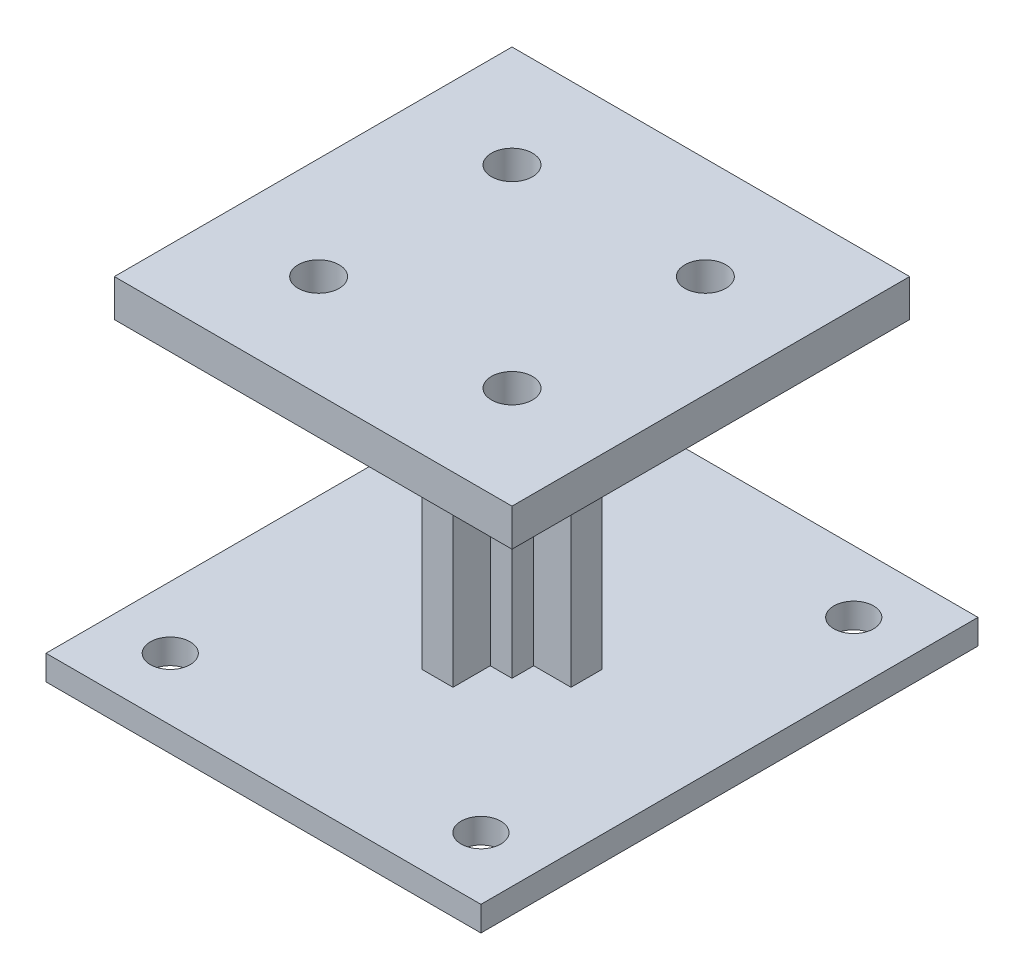
from build123d import *

# Parameters (mm, degrees)
SKETCH_1_W               = 35
SKETCH_1_H               = 40
EXTRUDE_1_DEPTH          = 2
SKETCH_2_R               = 1.6
CUT_EXTRUDE_1_DEPTH      = 2
SKETCH_3_W               = 6
SKETCH_3_H               = 6
EXTRUDE_2_DEPTH          = 22
SKETCH_4_W               = 32
SKETCH_4_H               = 32
SKETCH_4_R               = 1.65
EXTRUDE_3_DEPTH          = 3
SKETCH_5_W               = 2.5
SKETCH_5_H               = 22
EXTRUDE_4_DEPTH          = 3
PATTERN_CIRCULAR_1_COUNT = 4


with BuildPart() as part:
    # 草图1 → 凸台-拉伸1 (new body)
    with BuildSketch(Plane(origin=(0, 0, 0), x_dir=(1, 0, 0), z_dir=(0, 1, 0))):
        Rectangle(SKETCH_1_W, SKETCH_1_H)
    extrude(amount=EXTRUDE_1_DEPTH)

    # 草图2 → 切除-拉伸1 (cut)
    with BuildSketch(Plane(origin=(0, 2, 0), x_dir=(1, 0, 0), z_dir=(0, 1, 0))):
        with Locations(Location((-12.5, 15, 0), (0, 0, 270))):
            Circle(SKETCH_2_R)
        with Locations(Location((12.5, 15, 0), (0, 0, 90))):
            Circle(SKETCH_2_R)
        with Locations(Location((12.5, -15, 0), (0, 0, 270))):
            Circle(SKETCH_2_R)
        with Locations(Location((-12.5, -15, 0), (0, 0, 90))):
            Circle(SKETCH_2_R)
    extrude(amount=-CUT_EXTRUDE_1_DEPTH, mode=Mode.SUBTRACT)

    # 草图3 → 凸台-拉伸2 (add)
    with BuildSketch(Plane(origin=(0, 2, 0), x_dir=(1, 0, 0), z_dir=(0, 1, 0))):
        Rectangle(SKETCH_3_W, SKETCH_3_H)
    extrude(amount=EXTRUDE_2_DEPTH)

    # 草图4 → 凸台-拉伸3 (add)
    with BuildSketch(Plane(origin=(0, 24, 0), x_dir=(1, 0, 0), z_dir=(0, 1, 0))):
        Rectangle(SKETCH_4_W, SKETCH_4_H)
        with Locations(Location((-7.78, 7.78, 0), (0, 0, 270))):
            Circle(SKETCH_4_R, mode=Mode.SUBTRACT)
        with Locations(Location((7.78, 7.78, 0), (0, 0, 90))):
            Circle(SKETCH_4_R, mode=Mode.SUBTRACT)
        with Locations(Location((7.78, -7.78, 0), (0, 0, 270))):
            Circle(SKETCH_4_R, mode=Mode.SUBTRACT)
        with Locations(Location((-7.78, -7.78, 0), (0, 0, 90))):
            Circle(SKETCH_4_R, mode=Mode.SUBTRACT)
    extrude(amount=EXTRUDE_3_DEPTH)

    # 草图5 → 凸台-拉伸4 (add)
    with BuildSketch(Plane.XY.offset(3)):
        with Locations((0, 13)):
            Rectangle(SKETCH_5_W, SKETCH_5_H)
    extrude_4 = extrude(amount=EXTRUDE_4_DEPTH)

    # 阵列(圆周)1: 凸台-拉伸4 ×4 about axis
    pattern_circular_1_axis = Axis((0, 0, 0), (0, 1, 0))
    for i in range(1, PATTERN_CIRCULAR_1_COUNT):
        add(extrude_4.rotate(pattern_circular_1_axis, i * 360 / PATTERN_CIRCULAR_1_COUNT))


solid = part.part
